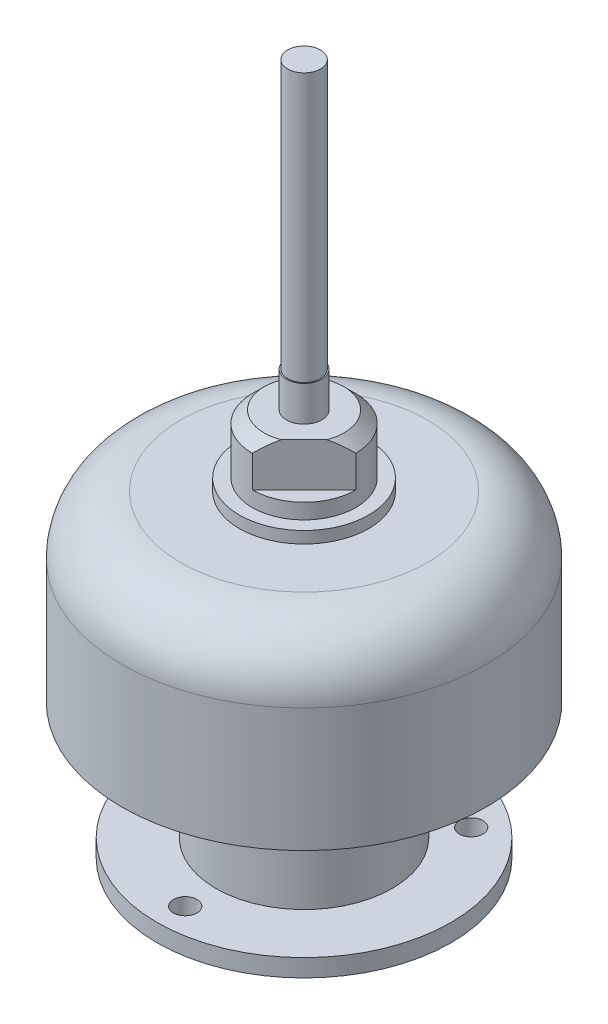
from build123d import *

# Parameters (mm, degrees)
SKETCH1_R       = 12.5
EXTRUDE1_DEPTH  = 1.5
SKETCH2_R       = 7.5
EXTRUDE2_DEPTH  = 5
SKETCH3_R       = 5
EXTRUDE3_DEPTH  = 5
SKETCH4_R       = 15.5
EXTRUDE4_DEPTH  = 15.5
SKETCH5_R       = 5.5
EXTRUDE5_DEPTH  = 1
SKETCH6_R       = 4.4
EXTRUDE6_DEPTH  = 5
EXTRUDE7_START  = -3.7
EXTRUDE7_DEPTH  = 3.7
SKETCH8_R       = 1.5
EXTRUDE8_DEPTH  = 3
SKETCH9_R       = 1.4
EXTRUDE9_DEPTH  = 22.8
SKETCH10_R      = 4.4
EXTRUDE10_DEPTH = 2
EXTRUDE11_START = 3.3
SKETCH11_R      = 1.5
EXTRUDE11_DEPTH = 3.3
EXTRUDE12_REACH = 64.753
SKETCH12_R      = 1
FILLET1_R       = 5
CHAMFER1_SIZE   = 1


with BuildPart() as part:
    # Sketch1 → Extrude1 (new body)
    with BuildSketch(Plane(origin=(0, 0, 0), x_dir=(1, 0, 0), z_dir=(0, 1, 0))):
        with Locations(Location((0, 0, 0), (0, 0, 270))):
            Circle(SKETCH1_R)
    extrude(amount=EXTRUDE1_DEPTH)

    # Sketch2 → Extrude2 (add)
    with BuildSketch(Plane(origin=(0, 1.5, 0), x_dir=(1, 0, 0), z_dir=(0, 1, 0))):
        with Locations(Location((0, 0, 0), (0, 0, 270))):
            Circle(SKETCH2_R)
    extrude(amount=EXTRUDE2_DEPTH)

    # Sketch3 → Extrude3 (add)
    with BuildSketch(Plane(origin=(0, 6.5, 0), x_dir=(1, 0, 0), z_dir=(0, 1, 0))):
        with Locations(Location((0, 0, 0), (0, 0, 270))):
            Circle(SKETCH3_R)
    extrude(amount=EXTRUDE3_DEPTH)

    # Sketch4 → Extrude4 (add)
    with BuildSketch(Plane(origin=(0, 11.5, 0), x_dir=(1, 0, 0), z_dir=(0, 1, 0))):
        with Locations(Location((0, 0, 0), (0, 0, 270))):
            Circle(SKETCH4_R)
    extrude(amount=EXTRUDE4_DEPTH)

    # Sketch5 → Extrude5 (add)
    with BuildSketch(Plane(origin=(0, 27, 0), x_dir=(1, 0, 0), z_dir=(0, 1, 0))):
        with Locations(Location((0, 0, 0), (0, 0, 270))):
            Circle(SKETCH5_R)
    extrude(amount=EXTRUDE5_DEPTH)

    # Sketch6 → Extrude6 (add)
    with BuildSketch(Plane(origin=(0, 28, 0), x_dir=(1, 0, 0), z_dir=(0, 1, 0))):
        with Locations(Location((0, 0, 0), (0, 0, 270))):
            Circle(SKETCH6_R)
    extrude(amount=EXTRUDE6_DEPTH)

    # Sketch7 → Extrude7 (cut)
    with BuildSketch(Plane(origin=(0, 33, 0), x_dir=(1, 0, 0), z_dir=(0, 1, 0)).offset(EXTRUDE7_START)):
        with BuildLine():
            Line((0, 4.4), (-4.4, 0))
            ThreePointArc((-4.4, 0), (-3.111269837, 3.111269837), (0, 4.4))
        make_face()
        with BuildLine():
            Line((4.4, 0), (0, -4.4))
            ThreePointArc((0, -4.4), (3.111269837, -3.111269837), (4.4, 0))
        make_face()
    extrude(amount=EXTRUDE7_DEPTH, mode=Mode.SUBTRACT)

    # Sketch8 → Extrude8 (add)
    with BuildSketch(Plane(origin=(0, 33, 0), x_dir=(1, 0, 0), z_dir=(0, 1, 0))):
        with Locations(Location((0, 0, 0), (0, 0, 270))):
            Circle(SKETCH8_R)
    extrude(amount=EXTRUDE8_DEPTH)

    # Sketch9 → Extrude9 (add)
    with BuildSketch(Plane(origin=(0, 36, 0), x_dir=(1, 0, 0), z_dir=(0, 1, 0))):
        with Locations(Location((0, 0, 0), (0, 0, 270))):
            Circle(SKETCH9_R)
    extrude(amount=EXTRUDE9_DEPTH)

    # Sketch10 → Extrude10 (cut)
    with BuildSketch(Plane.XZ):
        with Locations(Location((0, 0, 0), (0, 0, 90))):
            Circle(SKETCH10_R)
    extrude(amount=-EXTRUDE10_DEPTH, mode=Mode.SUBTRACT)

    # Sketch11 → Extrude11 (add)
    with BuildSketch(Plane.XZ.offset(-2).offset(EXTRUDE11_START)):
        with Locations(Location((0, 0, 0), (0, 0, 90))):
            Circle(SKETCH11_R)
    extrude(amount=-EXTRUDE11_DEPTH)

    # Sketch12 → Extrude12 (cut, up to next)
    with BuildSketch(Plane.XZ, mode=Mode.PRIVATE) as extrude12_sk1:
        with Locations(Location((0, 10.102788136, 0), (0, 0, 270))):
            Circle(SKETCH12_R)
    extrude12_tool1 = extrude(extrude12_sk1.sketch, amount=-EXTRUDE12_REACH, mode=Mode.PRIVATE) & part.part
    # Sketch12 → Extrude12 (cut, up to next)
    with BuildSketch(Plane.XZ, mode=Mode.PRIVATE) as extrude12_sk2:
        with Locations(Location((-6.35, -7.857724106, 0), (0, 0, 270))):
            Circle(SKETCH12_R)
    extrude12_tool2 = extrude(extrude12_sk2.sketch, amount=-EXTRUDE12_REACH, mode=Mode.PRIVATE) & part.part
    # Sketch12 → Extrude12 (cut, up to next)
    with BuildSketch(Plane.XZ, mode=Mode.PRIVATE) as extrude12_sk3:
        with Locations(Location((6.35, -7.857724106, 0), (0, 0, 270))):
            Circle(SKETCH12_R)
    extrude12_tool3 = extrude(extrude12_sk3.sketch, amount=-EXTRUDE12_REACH, mode=Mode.PRIVATE) & part.part
    add(extrude12_tool1.solids().sort_by_distance((0, 0, 10.102788))[0], mode=Mode.SUBTRACT)
    add(extrude12_tool2.solids().sort_by_distance((-6.35, 0, -7.857724))[0], mode=Mode.SUBTRACT)
    add(extrude12_tool3.solids().sort_by_distance((6.35, 0, -7.857724))[0], mode=Mode.SUBTRACT)

    # Fillet1
    fillet1_edges = [part.edges().sort_by_distance(p)[0] for p in [
        (0, 27, -15.5),
    ]]
    fillet(fillet1_edges, radius=FILLET1_R)

    # Chamfer1
    chamfer1_edges = [part.edges().sort_by_distance(p)[0] for p in [
        (-3.111269837, 33, 3.111269837),
        (3.111269837, 33, -3.111269837),
    ]]
    chamfer(chamfer1_edges, length=CHAMFER1_SIZE)


solid = part.part
